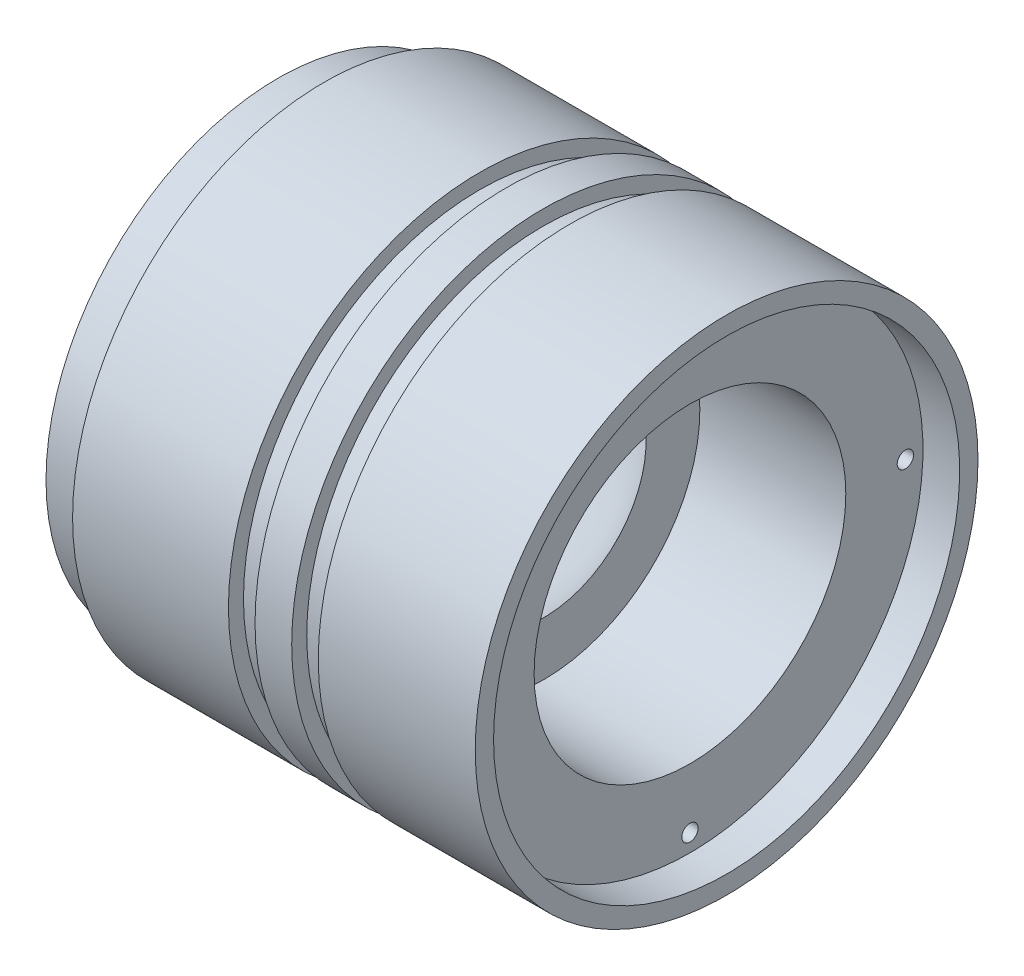
from build123d import *

# Parameters (mm, degrees)
SKETCH1_W         = 101.6
SKETCH1_H         = 34.8234
SKETCH3_W         = 6.35
SKETCH3_H         = 2.667
SKETCH4_W         = 38.1
SKETCH4_H         = 9.017
CIRPATTERN1_COUNT = 4
SKETCH8_W         = 3.683
SKETCH8_H         = 2.0828


with BuildPart() as part:
    # Sketch1 → Revolve1 (revolve)
    with BuildSketch(Plane.XY, mode=Mode.PRIVATE) as revolve1_sk:
        with Locations((50.8, 17.4117)):
            Rectangle(SKETCH1_W, SKETCH1_H)
    revolve(revolve1_sk.sketch.rotate(Axis((-14.406993702, 0, 0), (1, 0, 0)), 90), axis=Axis((-14.406993702, 0, 0), (1, 0, 0)))

    # Sketch2 → Cut-Revolve1 (revolve, cut)
    with BuildSketch(Plane.XY, mode=Mode.PRIVATE) as cut_revolve1_sk:
        with BuildLine():
            Line((0, 28.4734), (10.16, 28.4734))
            ThreePointArc((10.16, 28.4734), (25.296207294, 24.666285192), (36.83, 14.151033402))
            ThreePointArc((36.83, 14.151033402), (41.000418166, 10.205778874), (46.482, 8.5))
            ThreePointArc((46.482, 8.5), (47.320563586, 8.54516677), (48.120613895, 8.800408672))
            add(Edge.make_bspline(
                [(101.6, 24.9936), (69.441940144, 18.742706384), (48.120613895, 8.800408672)],
                knots=[0, 0, 0, 1, 1, 1], degree=2))
            Line((101.6, 24.9936), (101.6, 0))
            Line((101.6, 0), (0, 0))
            Line((0, 0), (0, 28.4734))
        make_face()
    revolve(cut_revolve1_sk.sketch.rotate(Axis((-14.406993702, 0, 0), (1, 0, 0)), 90), axis=Axis((-14.406993702, 0, 0), (1, 0, 0)), mode=Mode.SUBTRACT)

    # Sketch3 → Cut-Revolve2 (revolve, cut)
    with BuildSketch(Plane.XY, mode=Mode.PRIVATE) as cut_revolve2_sk:
        with Locations((3.175, 33.4899)):
            Rectangle(SKETCH3_W, SKETCH3_H)
    revolve(cut_revolve2_sk.sketch.rotate(Axis((-14.406993702, 0, 0), (1, 0, 0)), 90), axis=Axis((-14.406993702, 0, 0), (1, 0, 0)), mode=Mode.SUBTRACT)

    # Sketch4 → Cut-Revolve3 (revolve, cut)
    with BuildSketch(Plane.XY, mode=Mode.PRIVATE) as cut_revolve3_sk:
        with Locations((82.55, 30.3149)):
            Rectangle(SKETCH4_W, SKETCH4_H)
    revolve(cut_revolve3_sk.sketch.rotate(Axis((-14.406993702, 0, 0), (1, 0, 0)), 90), axis=Axis((-14.406993702, 0, 0), (1, 0, 0)), mode=Mode.SUBTRACT)

    # Sketch5 → Cut-Revolve4 (revolve, cut)
    with BuildSketch(Plane.XY, mode=Mode.PRIVATE) as cut_revolve4_sk:
        Polygon((36.83, 0), (36.83, 21.59), (57.0484, 21.59), (57.0484, 32.2834), (62.1284, 32.2834), (62.1284, 34.8234), (101.599999985, 34.8234), (101.599999985, 0), align=None)
    revolve(cut_revolve4_sk.sketch.rotate(Axis((-14.406993702, 0, 0), (1, 0, 0)), 90), axis=Axis((-14.406993702, 0, 0), (1, 0, 0)), mode=Mode.SUBTRACT)

    # Sketch7 → #4-40 Tapped Hole1 (revolve, cut)
    with BuildSketch(Plane(origin=(57.0484, 29.845, 0), x_dir=(0, 0, -1), z_dir=(0, 1, 0))):
        Polygon((0, 0), (0, 10.839152758), (1.1303, 10.16), (1.1303, 0), align=None)
    f_4_40_tapped_hole1 = revolve(axis=Axis((63.3984, 29.845, 0), (-1, 0, 0)), mode=Mode.SUBTRACT)

    # CirPattern1: #4-40 Tapped Hole1 ×4 about axis
    cirpattern1_axis = Axis((0, 0, 0), (1, 0, 0))
    for i in range(1, CIRPATTERN1_COUNT):
        add(f_4_40_tapped_hole1.rotate(cirpattern1_axis, i * 360 / CIRPATTERN1_COUNT), mode=Mode.SUBTRACT)

    # Sketch8 → Cut-Revolve5 (revolve, cut)
    with BuildSketch(Plane.XY, mode=Mode.PRIVATE) as cut_revolve5_sk:
        with Locations((29.7815, 33.782)):
            Rectangle(SKETCH8_W, SKETCH8_H)
        with Locations((38.5445, 33.782)):
            Rectangle(SKETCH8_W, SKETCH8_H)
    revolve(cut_revolve5_sk.sketch.rotate(Axis((-14.406993702, 0, 0), (1, 0, 0)), 90), axis=Axis((-14.406993702, 0, 0), (1, 0, 0)), mode=Mode.SUBTRACT)


solid = part.part
